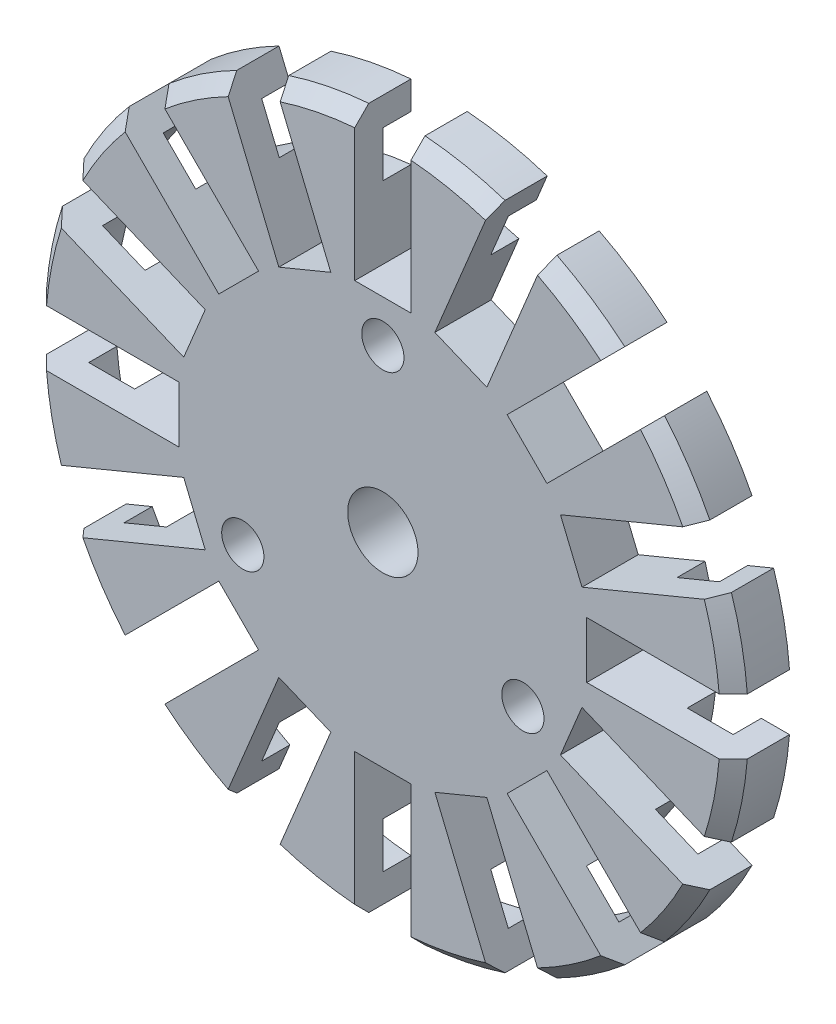
from build123d import *

# Parameters (mm, degrees)
ESBO_O1_R             = 25
EXTRUS_O1_DEPTH       = 4
EXTRUS_O2_DEPTH       = 1
EXTRUS_O2_DEPTH_BACK  = 5
CHANFRO1_SIZE         = 1
CIRPATTERN1_COUNT     = 16
ESBO_O5_R             = 1.5
ESBO_O5_R_2           = 2.5
CORTE_EXTRUS_O2_DEPTH = 36.468295702
ESBO_O8_R             = 23
ESBO_O8_R_2           = 19.75
CORTE_EXTRUS_O4_DEPTH = 2


with BuildPart() as part:
    # Esboço1 → Extrusão1 (new body)
    with BuildSketch(Plane.XY):
        Circle(ESBO_O1_R)
    extrude(amount=EXTRUS_O1_DEPTH)

    # Chanfro1
    chanfro1_edges = [part.edges().sort_by_distance(p)[0] for p in [
        (-25, 0, 4),
    ]]
    chamfer(chanfro1_edges, length=CHANFRO1_SIZE)


with BuildPart() as body_2:
    # Esboço2 → Extrusão2 (new, two sides: drawn at the far end of the back side and taken through both)
    with BuildSketch(Plane.XY.offset(4).offset(-EXTRUS_O2_DEPTH_BACK)):
        Polygon((0, 14.5), (2, 14.5), (2, 29.5), (-2, 29.5), (-2, 14.5), align=None)
    extrude(amount=EXTRUS_O2_DEPTH + EXTRUS_O2_DEPTH_BACK)


with BuildPart() as cirpattern1_1:
    # CirPattern1: pattern copy
    add(body_2.part.rotate(Axis((0, 0, 22.401142828), (0, 0, -1)), 1 * 360 / CIRPATTERN1_COUNT))


with BuildPart() as cirpattern1_2:
    # CirPattern1: pattern copy
    add(body_2.part.rotate(Axis((0, 0, 22.401142828), (0, 0, -1)), 2 * 360 / CIRPATTERN1_COUNT))


with BuildPart() as cirpattern1_3:
    # CirPattern1: pattern copy
    add(body_2.part.rotate(Axis((0, 0, 22.401142828), (0, 0, -1)), 3 * 360 / CIRPATTERN1_COUNT))


with BuildPart() as cirpattern1_4:
    # CirPattern1: pattern copy
    add(body_2.part.rotate(Axis((0, 0, 22.401142828), (0, 0, -1)), 4 * 360 / CIRPATTERN1_COUNT))


with BuildPart() as cirpattern1_5:
    # CirPattern1: pattern copy
    add(body_2.part.rotate(Axis((0, 0, 22.401142828), (0, 0, -1)), 5 * 360 / CIRPATTERN1_COUNT))


with BuildPart() as cirpattern1_6:
    # CirPattern1: pattern copy
    add(body_2.part.rotate(Axis((0, 0, 22.401142828), (0, 0, -1)), 6 * 360 / CIRPATTERN1_COUNT))


with BuildPart() as cirpattern1_7:
    # CirPattern1: pattern copy
    add(body_2.part.rotate(Axis((0, 0, 22.401142828), (0, 0, -1)), 7 * 360 / CIRPATTERN1_COUNT))


with BuildPart() as cirpattern1_8:
    # CirPattern1: pattern copy
    add(body_2.part.rotate(Axis((0, 0, 22.401142828), (0, 0, -1)), 8 * 360 / CIRPATTERN1_COUNT))


with BuildPart() as cirpattern1_9:
    # CirPattern1: pattern copy
    add(body_2.part.rotate(Axis((0, 0, 22.401142828), (0, 0, -1)), 9 * 360 / CIRPATTERN1_COUNT))


with BuildPart() as cirpattern1_10:
    # CirPattern1: pattern copy
    add(body_2.part.rotate(Axis((0, 0, 22.401142828), (0, 0, -1)), 10 * 360 / CIRPATTERN1_COUNT))


with BuildPart() as cirpattern1_11:
    # CirPattern1: pattern copy
    add(body_2.part.rotate(Axis((0, 0, 22.401142828), (0, 0, -1)), 11 * 360 / CIRPATTERN1_COUNT))


with BuildPart() as cirpattern1_12:
    # CirPattern1: pattern copy
    add(body_2.part.rotate(Axis((0, 0, 22.401142828), (0, 0, -1)), 12 * 360 / CIRPATTERN1_COUNT))


with BuildPart() as cirpattern1_13:
    # CirPattern1: pattern copy
    add(body_2.part.rotate(Axis((0, 0, 22.401142828), (0, 0, -1)), 13 * 360 / CIRPATTERN1_COUNT))


with BuildPart() as cirpattern1_14:
    # CirPattern1: pattern copy
    add(body_2.part.rotate(Axis((0, 0, 22.401142828), (0, 0, -1)), 14 * 360 / CIRPATTERN1_COUNT))


with BuildPart() as cirpattern1_15:
    # CirPattern1: pattern copy
    add(body_2.part.rotate(Axis((0, 0, 22.401142828), (0, 0, -1)), 15 * 360 / CIRPATTERN1_COUNT))


with BuildPart() as part_1:
    add(part.part)

    # Combinar1: cut CirPattern1_15, body 2, CirPattern1_1, CirPattern1_2, CirPattern1_3, CirPattern1_4, CirPattern1_5, CirPattern1_6, CirPattern1_7, CirPattern1_8, CirPattern1_9, CirPattern1_10, CirPattern1_11, CirPattern1_12, CirPattern1_13, CirPattern1_14
    add(cirpattern1_15.part, mode=Mode.SUBTRACT)
    add(body_2.part, mode=Mode.SUBTRACT)
    add(cirpattern1_1.part, mode=Mode.SUBTRACT)
    add(cirpattern1_2.part, mode=Mode.SUBTRACT)
    add(cirpattern1_3.part, mode=Mode.SUBTRACT)
    add(cirpattern1_4.part, mode=Mode.SUBTRACT)
    add(cirpattern1_5.part, mode=Mode.SUBTRACT)
    add(cirpattern1_6.part, mode=Mode.SUBTRACT)
    add(cirpattern1_7.part, mode=Mode.SUBTRACT)
    add(cirpattern1_8.part, mode=Mode.SUBTRACT)
    add(cirpattern1_9.part, mode=Mode.SUBTRACT)
    add(cirpattern1_10.part, mode=Mode.SUBTRACT)
    add(cirpattern1_11.part, mode=Mode.SUBTRACT)
    add(cirpattern1_12.part, mode=Mode.SUBTRACT)
    add(cirpattern1_13.part, mode=Mode.SUBTRACT)
    add(cirpattern1_14.part, mode=Mode.SUBTRACT)

    # Esboço5 → Corte-extrusão2 (cut, through all)
    with BuildSketch(Plane.XY.offset(4)):
        with Locations((0, 11.5)):
            Circle(ESBO_O5_R)
        with Locations((9.959292144, -5.75)):
            Circle(ESBO_O5_R)
        with Locations((-9.959292144, -5.75)):
            Circle(ESBO_O5_R)
        Circle(ESBO_O5_R_2)
    extrude(amount=-CORTE_EXTRUS_O2_DEPTH, mode=Mode.SUBTRACT)

    # Esboço8 → Corte-extrusão4 (cut)
    with BuildSketch(Plane(origin=(0, 0, 0), x_dir=(-1, 0, 0), z_dir=(0, 0, -1))):
        Circle(ESBO_O8_R)
        Circle(ESBO_O8_R_2, mode=Mode.SUBTRACT)
    extrude(amount=-CORTE_EXTRUS_O4_DEPTH, mode=Mode.SUBTRACT)


solid = part_1.part
